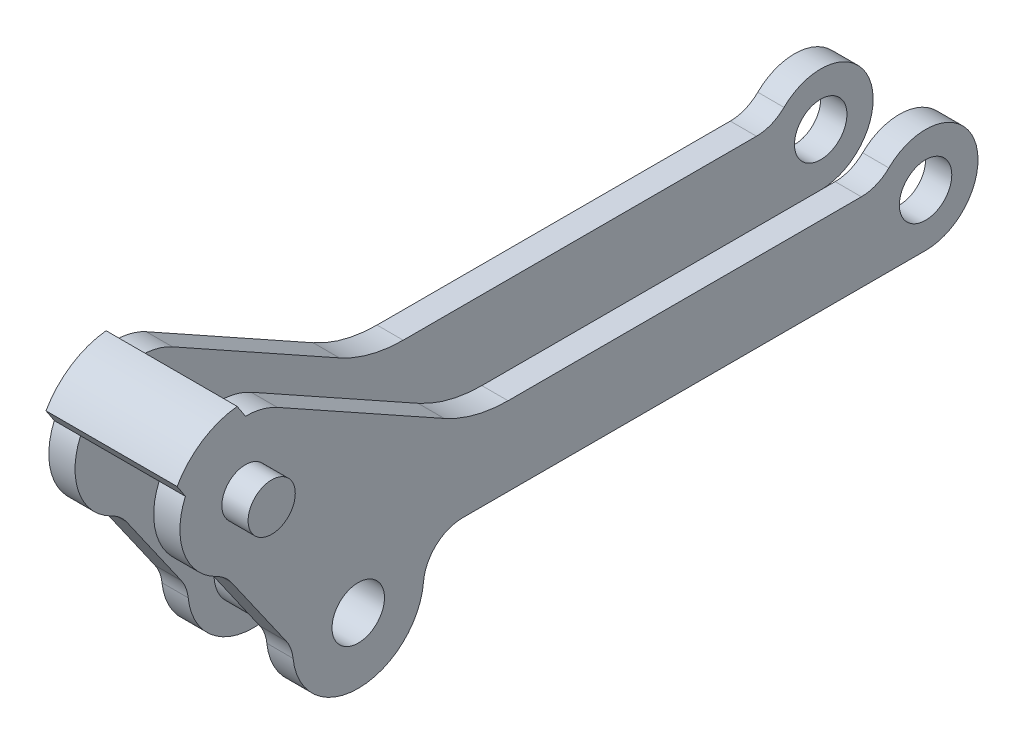
from build123d import *

# Parameters (mm, degrees)
EXTRUDE_1_DEPTH          = 2
SKETCH_1_4_R             = 3
EXTRUDE_2_DEPTH          = 2
CUT_EXTRUDE_1_DEPTH      = 51.040969284
CUT_EXTRUDE_1_DEPTH_BACK = 51.040969284
SKETCH_1_3_R             = 2
FILLET_1_R               = 3
EXTRUDE_START            = -2
SKETCH_2_R               = 2
EXTRUDE_3_DEPTH          = 2
SKETCH_2_3_R             = 1.8
EXTRUDE_4_DEPTH          = 2
EXTRUDE_6_DEPTH          = 2
EXTRUDE_START_2          = -5
EXTRUDE_5_DEPTH          = 5
FILLET_3_R               = 10


with BuildPart() as part:
    # 草图1 → 凸台-拉伸1 (new body)
    with BuildSketch(Plane(origin=(0, 0, 0), x_dir=(0, 0, -1), z_dir=(1, 0, 0))):
        with BuildLine():
            Line((40.737143614, 0), (0, 0))
            Line((0, 0), (2.48051592, -3.542543867))
            ThreePointArc((2.48051592, -3.542543867), (4.165783411, -4.487079684), (5.367176995, -6))
            Line((5.367176995, -6), (44.201245229, -6))
            ThreePointArc((44.201245229, -6), (40.737143614, -4), (40.737143614, 0))
        make_face()
        with BuildLine():
            Line((2.48051592, -3.542543867), (0, 0))
            Line((0, 0), (-2.681672007, 3.829824531))
            ThreePointArc((-2.681672007, 3.829824531), (-4.811127311, -0.102785303), (-9.234888361, -0.758786959))
            Line((-9.234888361, -0.758786959), (-4.072700434, -8.131155358))
            ThreePointArc((-4.072700434, -8.131155358), (-1.94324513, -4.198545524), (2.48051592, -3.542543867))
        make_face()
        with BuildLine():
            ThreePointArc((48.201245229, -2), (45.23652141, 1.863703305), (40.737143614, 0))
            Line((40.737143614, 0), (44.201245229, 0))
            ThreePointArc((44.201245229, 0), (45.615458792, -0.585786438), (46.201245229, -2))
            ThreePointArc((46.201245229, -2), (45.615458792, -3.414213562), (44.201245229, -4))
            Line((44.201245229, -4), (44.201245229, -6))
            ThreePointArc((44.201245229, -6), (47.029672354, -4.828427125), (48.201245229, -2))
        make_face()
        with BuildLine():
            Line((44.201245229, 0), (40.737143614, 0))
            ThreePointArc((40.737143614, 0), (40.737143614, -4), (44.201245229, -6))
            Line((44.201245229, -6), (44.201245229, -4))
            ThreePointArc((44.201245229, -4), (42.201245229, -2), (44.201245229, 0))
        make_face()
        with BuildLine():
            ThreePointArc((5.367176995, -6), (4.165783411, -4.487079684), (2.48051592, -3.542543867))
            Line((2.48051592, -3.542543867), (4.201245229, -6))
            Line((4.201245229, -6), (5.367176995, -6))
        make_face()
        with BuildLine():
            Line((4.201245229, -6), (2.48051592, -3.542543867))
            ThreePointArc((2.48051592, -3.542543867), (-1.94324513, -4.198545524), (-4.072700434, -8.131155358))
            Line((-4.072700434, -8.131155358), (-2.351971125, -10.588611491))
            Line((-2.351971125, -10.588611491), (-1.532819081, -10.015035054))
            ThreePointArc((-1.532819081, -10.015035054), (-0.796092257, -5.836849613), (3.382093185, -6.573576436))
            Line((3.382093185, -6.573576436), (4.201245229, -6))
        make_face()
        with BuildLine():
            ThreePointArc((-9.234888361, -0.758786959), (-4.811127311, -0.102785303), (-2.681672007, 3.829824531))
            Line((-2.681672007, 3.829824531), (-4.402401316, 6.287280664))
            Line((-4.402401316, 6.287280664), (-6.040705405, 5.140127792))
            ThreePointArc((-6.040705405, 5.140127792), (-5.771575592, 4.594386518), (-5.679009493, 3.992974919))
            ThreePointArc((-5.679009493, 3.992974919), (-7.077597894, 2.085541017), (-9.317313582, 2.845822046))
            Line((-9.317313582, 2.845822046), (-10.95561767, 1.698669174))
            Line((-10.95561767, 1.698669174), (-9.234888361, -0.758786959))
        make_face()
        with BuildLine():
            Line((-4.402401316, 6.287280664), (-2.681672007, 3.829824531))
            ThreePointArc((-2.681672007, 3.829824531), (-2.679675166, 3.911388863), (-2.679009493, 3.992974919))
            ThreePointArc((-2.679009493, 3.992974919), (-10.613341245, 8.041394014), (-9.234888361, -0.758786959))
            Line((-9.234888361, -0.758786959), (-10.95561767, 1.698669174))
            Line((-10.95561767, 1.698669174), (-9.317313582, 2.845822046))
            ThreePointArc((-9.317313582, 2.845822046), (-8.826162366, 5.631279008), (-6.040705405, 5.140127792))
            Line((-6.040705405, 5.140127792), (-4.402401316, 6.287280664))
        make_face()
        with BuildLine():
            ThreePointArc((46.201245229, -2), (45.615458792, -0.585786438), (44.201245229, 0))
            Line((44.201245229, 0), (44.201245229, -4))
            ThreePointArc((44.201245229, -4), (45.615458792, -3.414213562), (46.201245229, -2))
        make_face()
        with BuildLine():
            Line((44.201245229, -4), (44.201245229, 0))
            ThreePointArc((44.201245229, 0), (42.201245229, -2), (44.201245229, -4))
        make_face()
        with BuildLine():
            Line((5.367176995, -6), (4.201245229, -6))
            Line((4.201245229, -6), (3.382093185, -6.573576436))
            ThreePointArc((3.382093185, -6.573576436), (3.785787904, -7.392188347), (3.924637052, -8.294305745))
            ThreePointArc((3.924637052, -8.294305745), (1.826754451, -11.155456598), (-1.532819081, -10.015035054))
            Line((-1.532819081, -10.015035054), (-2.351971125, -10.588611491))
            Line((-2.351971125, -10.588611491), (-4.072700434, -8.131155358))
            ThreePointArc((-4.072700434, -8.131155358), (0.843050996, -13.293640073), (5.924637052, -8.294305745))
            ThreePointArc((5.924637052, -8.294305745), (5.783273678, -7.113776143), (5.367176995, -6))
        make_face()
        with BuildLine():
            ThreePointArc((3.924637052, -8.294305745), (3.785787904, -7.392188347), (3.382093185, -6.573576436))
            Line((3.382093185, -6.573576436), (2.562941141, -7.147152873))
            ThreePointArc((2.562941141, -7.147152873), (2.832070954, -7.692894146), (2.924637052, -8.294305745))
            ThreePointArc((2.924637052, -8.294305745), (1.526048651, -10.201739647), (-0.713667036, -9.441458618))
            Line((-0.713667036, -9.441458618), (-1.532819081, -10.015035054))
            ThreePointArc((-1.532819081, -10.015035054), (1.826754451, -11.155456598), (3.924637052, -8.294305745))
        make_face()
        with BuildLine():
            Line((2.562941141, -7.147152873), (3.382093185, -6.573576436))
            ThreePointArc((3.382093185, -6.573576436), (-0.796092257, -5.836849613), (-1.532819081, -10.015035054))
            Line((-1.532819081, -10.015035054), (-0.713667036, -9.441458618))
            ThreePointArc((-0.713667036, -9.441458618), (-0.222515821, -6.656001657), (2.562941141, -7.147152873))
        make_face()
        with BuildLine():
            ThreePointArc((-5.679009493, 3.992974919), (-5.771575592, 4.594386518), (-6.040705405, 5.140127792))
            Line((-6.040705405, 5.140127792), (-9.317313582, 2.845822046))
            ThreePointArc((-9.317313582, 2.845822046), (-7.077597894, 2.085541017), (-5.679009493, 3.992974919))
        make_face()
        with BuildLine():
            Line((-9.317313582, 2.845822046), (-6.040705405, 5.140127792))
            ThreePointArc((-6.040705405, 5.140127792), (-8.826162366, 5.631279008), (-9.317313582, 2.845822046))
        make_face()
        with BuildLine():
            ThreePointArc((2.924637052, -8.294305745), (2.832070954, -7.692894146), (2.562941141, -7.147152873))
            Line((2.562941141, -7.147152873), (-0.713667036, -9.441458618))
            ThreePointArc((-0.713667036, -9.441458618), (1.526048651, -10.201739647), (2.924637052, -8.294305745))
        make_face()
        with BuildLine():
            Line((-0.713667036, -9.441458618), (2.562941141, -7.147152873))
            ThreePointArc((2.562941141, -7.147152873), (-0.222515821, -6.656001657), (-0.713667036, -9.441458618))
        make_face()
    extrude(amount=EXTRUDE_1_DEPTH)

    # 草图1<4> → 凸台-拉伸2 (add)
    with BuildSketch(Plane(origin=(0, 0, 0), x_dir=(0, 0, -1), z_dir=(1, 0, 0))):
        with Locations((0.924637052, -8.294305745)):
            Circle(SKETCH_1_4_R)
    extrude(amount=-EXTRUDE_2_DEPTH)

    # 草图1<3> → 切除-拉伸1 (cut, two sides: drawn at the far end of the back side and taken through both)
    with BuildSketch(Plane(origin=(0, 0, 0), x_dir=(0, 0, -1), z_dir=(1, 0, 0)).offset(-CUT_EXTRUDE_1_DEPTH_BACK)):
        with Locations((-7.679009493, 3.992974919)):
            Circle(SKETCH_1_3_R)
        with Locations((44.201245229, -2)):
            Circle(SKETCH_1_3_R)
        with Locations((0.924637052, -8.294305745)):
            Circle(SKETCH_1_3_R)
    extrude(amount=CUT_EXTRUDE_1_DEPTH + CUT_EXTRUDE_1_DEPTH_BACK, mode=Mode.SUBTRACT)

    # 圆角1
    fillet_1_edges = [part.edges().sort_by_distance(p)[0] for p in [
        (1, -6, -5.367176995),
        (1, 0, 0),
        (1, 0, -40.737143614),
        (1, -0.758786959, 9.234888361),
        (1, -8.131155358, 4.072700434),
    ]]
    fillet(fillet_1_edges, radius=FILLET_1_R)

    # 草图2 → 凸台-拉伸3 (add)
    with BuildSketch(Plane(origin=(2, 0, 0), x_dir=(0, 0, -1), z_dir=(1, 0, 0)).offset(EXTRUDE_START)):
        with Locations((-7.679009493, 3.992974919)):
            Circle(SKETCH_2_R)
    extrude(amount=EXTRUDE_3_DEPTH)

    # 草图2<3> → 凸台-拉伸4 (add)
    with BuildSketch(Plane(origin=(2, 0, 0), x_dir=(0, 0, -1), z_dir=(1, 0, 0))):
        with Locations((-7.679009493, 3.992974919)):
            Circle(SKETCH_2_3_R)
    extrude(amount=EXTRUDE_4_DEPTH)

    # 草图4 → 凸台-拉伸6 (add)
    with BuildSketch(Plane(origin=(2, 0, 0), x_dir=(0, 0, -1), z_dir=(1, 0, 0))):
        Polygon((-5.244772745, 8.360410259), (9.755227255, 0), (-5.244772745, 0), align=None)
    extrude(amount=-EXTRUDE_6_DEPTH)

    # 草图3 → 凸台-拉伸5 (add)
    with BuildSketch(Plane(origin=(2, 0, 0), x_dir=(0, 0, -1), z_dir=(1, 0, 0)).offset(EXTRUDE_START_2)):
        with BuildLine():
            Line((-12.894335644, 6.959517206), (-12.261585188, 5.992974919))
            ThreePointArc((-12.261585188, 5.992974919), (-10.417622281, 8.176275052), (-7.679009493, 8.992974919))
            Line((-7.679009493, 8.992974919), (-8.311759949, 9.959517206))
            ThreePointArc((-8.311759949, 9.959517206), (-10.965344838, 9.012935078), (-12.894335644, 6.959517206))
        make_face()
    extrude(amount=EXTRUDE_5_DEPTH)

    # 圆角3
    fillet_3_edges = [part.edges().sort_by_distance(p)[0] for p in [
        (1, 0, -9.755227255),
    ]]
    fillet(fillet_3_edges, radius=FILLET_3_R)

    # 镜向1: part across plane


with BuildPart() as part_1:
    add(part.part)
    add(part.part.mirror(Plane.ZY.offset(3)))


solid = part_1.part
